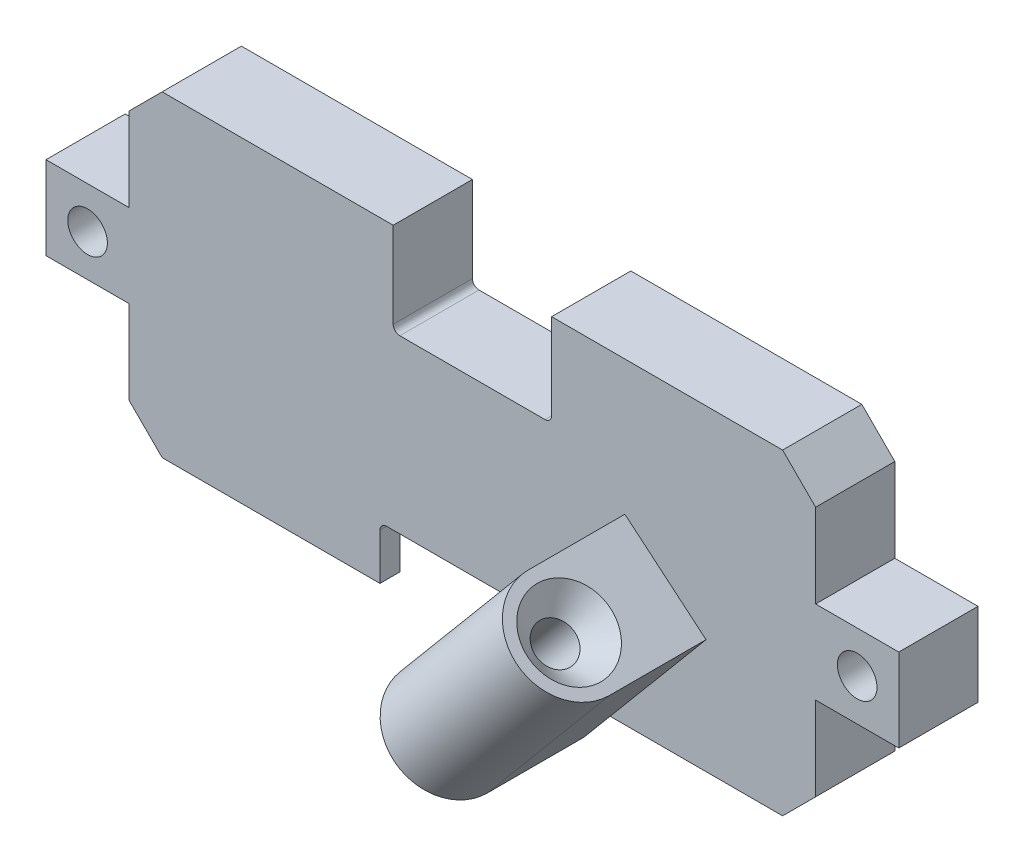
from build123d import *
from build123d.topology import SkipClean

# Parameters (mm, degrees)
BOSS_EXTRUDE1_START           = 5
BOSS_EXTRUDE1_DEPTH           = 6
CHAMFER1_SIZE                 = 4.5
SKETCH2_W                     = 6
SKETCH2_H                     = 6.3
BOSS_EXTRUDE2_DEPTH           = 6.3
BOSS_EXTRUDE3_DEPTH           = 7.3
BOSS_EXTRUDE4_DEPTH           = 14.405295
CSK_FOR_M3_SFHCS1_D           = 3
CSK_FOR_M3_SFHCS1_CSINK_D     = 6.3
CSK_FOR_M3_SFHCS1_CSINK_ANGLE = 90
CSK_FOR_M3_SFHCS2_D           = 3
CSK_FOR_M3_SFHCS2_CSINK_D     = 6.3
CSK_FOR_M3_SFHCS2_CSINK_ANGLE = 90


with BuildPart() as part:
    # Sketch1 → Boss-Extrude1 (new body)
    with BuildSketch(Plane.XY.offset(BOSS_EXTRUDE1_START)):
        with BuildLine():
            Line((-23.5, -12), (-7, -12))
            Line((-7, -12), (-7, -8.5))
            ThreePointArc((-7, -8.5), (-6.853553391, -8.146446609), (-6.5, -8))
            Line((-6.5, -8), (6.5, -8))
            ThreePointArc((6.5, -8), (6.853553391, -8.146446609), (7, -8.5))
            Line((7, -8.5), (7, -12))
            Line((7, -12), (23.5, -12))
            Line((23.5, -12), (26, -9.5))
            Line((26, -9.5), (26, -3.15))
            Line((26, -3.15), (32.3, -3.15))
            Line((32.3, -3.15), (32.3, 3.15))
            Line((32.3, 3.15), (26, 3.15))
            Line((26, 3.15), (26, 9.5))
            Line((26, 9.5), (23.5, 12))
            Line((23.5, 12), (6, 12))
            Line((6, 12), (6, 5.5))
            ThreePointArc((6, 5.5), (5.853553391, 5.146446609), (5.5, 5))
            Line((5.5, 5), (-5.5, 5))
            ThreePointArc((-5.5, 5), (-5.853553391, 5.146446609), (-6, 5.5))
            Line((-6, 5.5), (-6, 12))
            Line((-6, 12), (-23.5, 12))
            Line((-23.5, 12), (-26, 9.5))
            Line((-26, 9.5), (-26, 3.15))
            Line((-26, 3.15), (-32.3, 3.15))
            Line((-32.3, 3.15), (-32.3, -3.15))
            Line((-32.3, -3.15), (-26, -3.15))
            Line((-26, -3.15), (-26, -9.5))
            Line((-26, -9.5), (-23.5, -12))
        make_face()
    extrude(amount=BOSS_EXTRUDE1_DEPTH)

    # Chamfer1
    chamfer1_edges = [part.edges().sort_by_distance(p)[0] for p in [
        (7, -10.25, 5),
        (6.853553391, -8.146446609, 5),
        (0, -8, 5),
        (-6.853553391, -8.146446609, 5),
        (-7, -10.25, 5),
    ]]
    chamfer(chamfer1_edges, length=CHAMFER1_SIZE)

    # Sketch2 → Boss-Extrude2 (add)
    with BuildSketch(Plane(origin=(26, 0, 0), x_dir=(0, 0, -1), z_dir=(1, 0, 0))):
        with Locations((-8, 0)):
            Rectangle(SKETCH2_W, SKETCH2_H)
    boss_extrude2 = extrude(amount=BOSS_EXTRUDE2_DEPTH)

    # Mirror1: Boss-Extrude2 across plane
    add(boss_extrude2.mirror(Plane(origin=(0, 0, 0), x_dir=(0, 0, 1), z_dir=(1, 0, 0))))

    # Sketch3 → Boss-Extrude3 (add)
    with BuildSketch(Plane.XY.offset(11)):
        Polygon((11.551404138, 1.816830905), (2.291859281, -9.218264944), (8.439052056, -14.376372134), (17.698596913, -3.341276285), align=None)
    extrude(amount=BOSS_EXTRUDE3_DEPTH)

    # Sketch4 → Boss-Extrude4 (add)
    with SkipClean():  # the faces are left unmerged after this step: merging them gives an invalid solid
        with BuildSketch(Plane(origin=(5.667376511, 6.754116317, 0), x_dir=(0.7660444431189792, -0.6427876096865379, 0), z_dir=(0.6427876096865379, 0.7660444431189792, 0))):
            with BuildLine():
                Line((15.705642813, -18.3), (7.681052555, -18.3))
                ThreePointArc((7.681052555, -18.3), (11.693347684, -22.312295129), (15.705642813, -18.3))
            make_face()
        extrude(amount=-BOSS_EXTRUDE4_DEPTH)

    # CSK for M3 SFHCS1 (through all)
    with Locations(Plane(origin=(5.667376511, 6.754116317, 0), x_dir=(0.7660444431189792, -0.6427876096865379, 0), z_dir=(0.6427876096865379, 0.7660444431189792, 0))):
        with Locations((11.693347684, -18.3)):
            CounterSinkHole(CSK_FOR_M3_SFHCS1_D / 2, CSK_FOR_M3_SFHCS1_CSINK_D / 2, counter_sink_angle=CSK_FOR_M3_SFHCS1_CSINK_ANGLE)

    # CSK for M3 SFHCS2 (through all)
    with Locations(Plane(origin=(-1490.377712475, -7.825775805, -12), x_dir=(-0.766044443118981, 0.6427876096865359, 0), z_dir=(0, 0, -1))):
        with Locations((-1114.335057549, 945.253960578), (-1158.995448583, 982.728478223)):
            CounterSinkHole(CSK_FOR_M3_SFHCS2_D / 2, CSK_FOR_M3_SFHCS2_CSINK_D / 2, counter_sink_angle=CSK_FOR_M3_SFHCS2_CSINK_ANGLE)


solid = part.part
